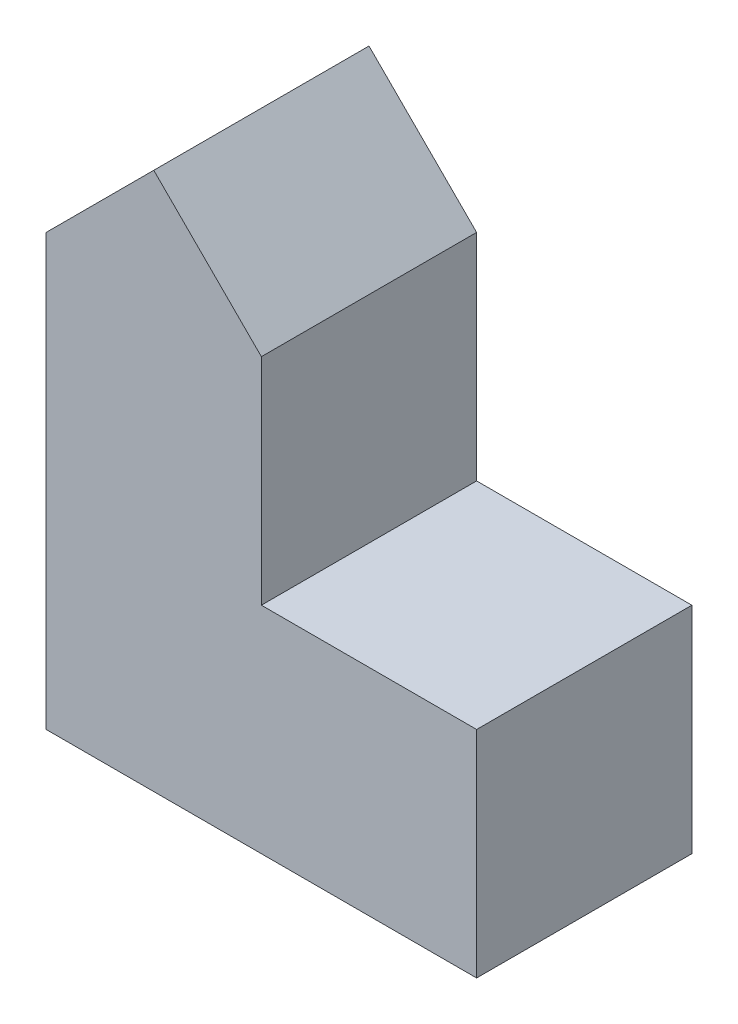
from build123d import *

# Parameters (mm, degrees)
BOSS_EXTRUDE1_DEPTH = 10


with BuildPart() as part:
    # Sketch1 → Boss-Extrude1 (new body)
    with BuildSketch(Plane.XY):
        Polygon((0, 0), (20, 0), (20, 10), (10, 10), (10, 20), (5, 25), (0, 20), align=None)
    extrude(amount=BOSS_EXTRUDE1_DEPTH)


solid = part.part
